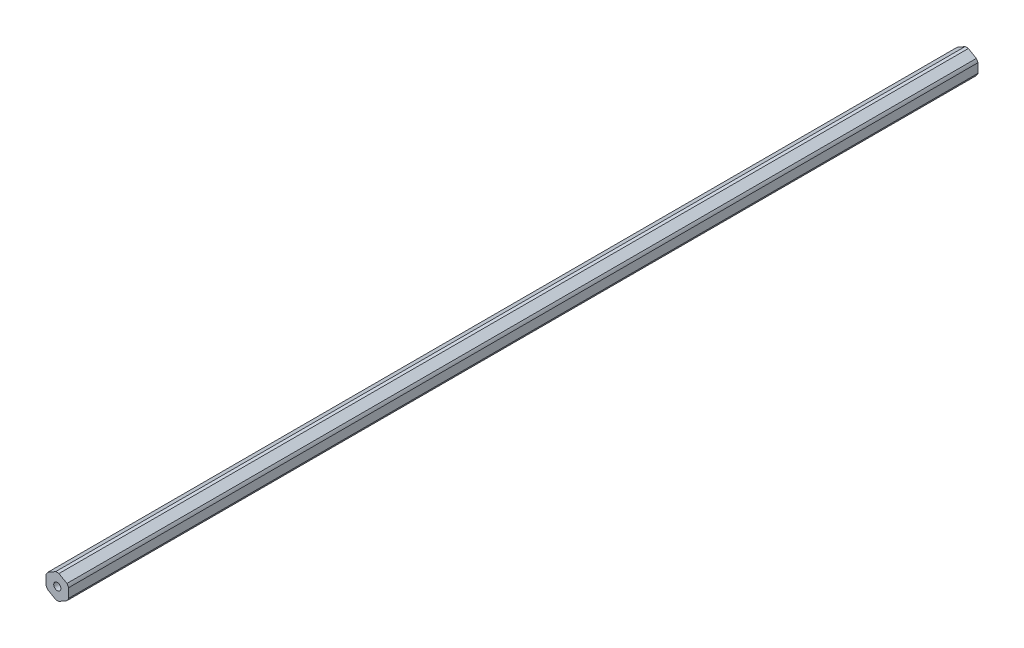
from build123d import *

# Parameters (mm, degrees)
BOSS_EXTRUDE1_DEPTH = 255.7145
SKETCH2_R           = 2.0193
CUT_EXTRUDE1_DEPTH  = 512.514395403


with BuildPart() as part:
    # Sketch1 → Boss-Extrude1 (new, symmetric)
    with BuildSketch(Plane.XY):
        with BuildLine():
            ThreePointArc((0.93173274, 6.79441227), (0, 6.858), (-0.93173274, 6.79441227))
            Line((-0.93173274, 6.79441227), (-5.41826726, 4.204110358))
            ThreePointArc((-5.41826726, 4.204110358), (-5.939202219, 3.429), (-6.35, 2.590301913))
            Line((-6.35, 2.590301913), (-6.35, -2.590301913))
            ThreePointArc((-6.35, -2.590301913), (-5.939202219, -3.429), (-5.41826726, -4.204110358))
            Line((-5.41826726, -4.204110358), (-0.93173274, -6.79441227))
            ThreePointArc((-0.93173274, -6.79441227), (0, -6.858), (0.93173274, -6.79441227))
            Line((0.93173274, -6.79441227), (5.41826726, -4.204110358))
            ThreePointArc((5.41826726, -4.204110358), (5.939202219, -3.429), (6.35, -2.590301913))
            Line((6.35, -2.590301913), (6.35, 2.590301913))
            ThreePointArc((6.35, 2.590301913), (5.939202219, 3.429), (5.41826726, 4.204110358))
            Line((5.41826726, 4.204110358), (0.93173274, 6.79441227))
        make_face()
    extrude(amount=BOSS_EXTRUDE1_DEPTH, both=True)

    # Sketch2 → Cut-Extrude1 (cut, through all)
    with BuildSketch(Plane.XY.offset(255.7145)):
        Circle(SKETCH2_R)
    extrude(amount=-CUT_EXTRUDE1_DEPTH, mode=Mode.SUBTRACT)


solid = part.part
